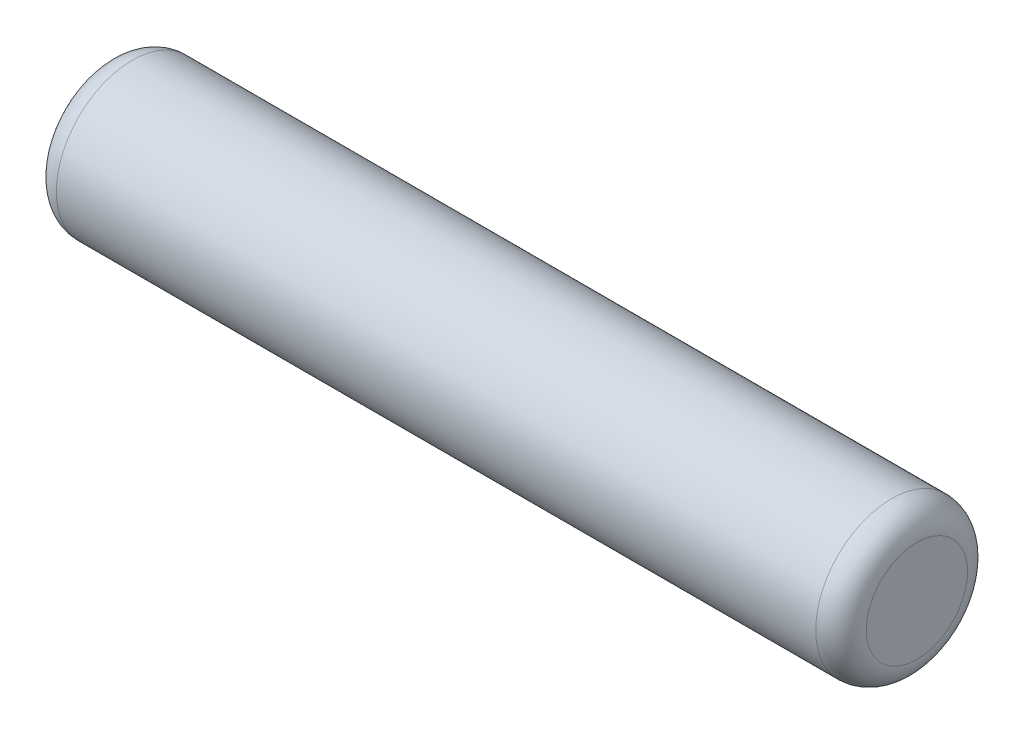
from build123d import *

# Parameters (mm, degrees)
SKETCH1_R           = 1.5
BOSS_EXTRUDE1_DEPTH = 16
FILLET1_R           = 0.5


with BuildPart() as part:
    # Sketch1 → Boss-Extrude1 (new body)
    with BuildSketch(Plane(origin=(0, 0, 0), x_dir=(0, 0, -1), z_dir=(1, 0, 0))):
        Circle(SKETCH1_R)
    extrude(amount=BOSS_EXTRUDE1_DEPTH)

    # Fillet1
    fillet1_edges = [part.edges().sort_by_distance(p)[0] for p in [
        (0, 0, 1.5),
        (16, 0, 1.5),
    ]]
    fillet(fillet1_edges, radius=FILLET1_R)


solid = part.part
